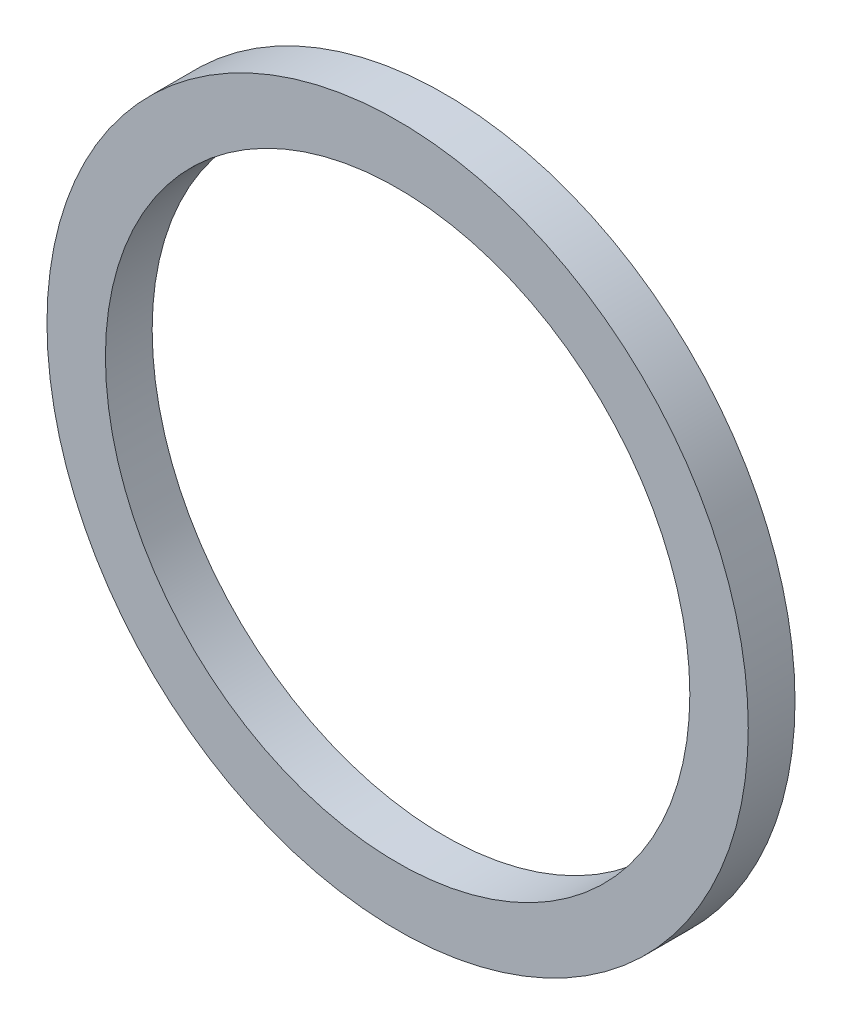
from build123d import *

# Parameters (mm, degrees)
SKETCH1_R           = 15
SKETCH1_R_2         = 12.5
BOSS_EXTRUDE1_DEPTH = 2


with BuildPart() as part:
    # Sketch1 → Boss-Extrude1 (new body)
    with BuildSketch(Plane.XY):
        Circle(SKETCH1_R)
        Circle(SKETCH1_R_2, mode=Mode.SUBTRACT)
    extrude(amount=BOSS_EXTRUDE1_DEPTH)


solid = part.part
